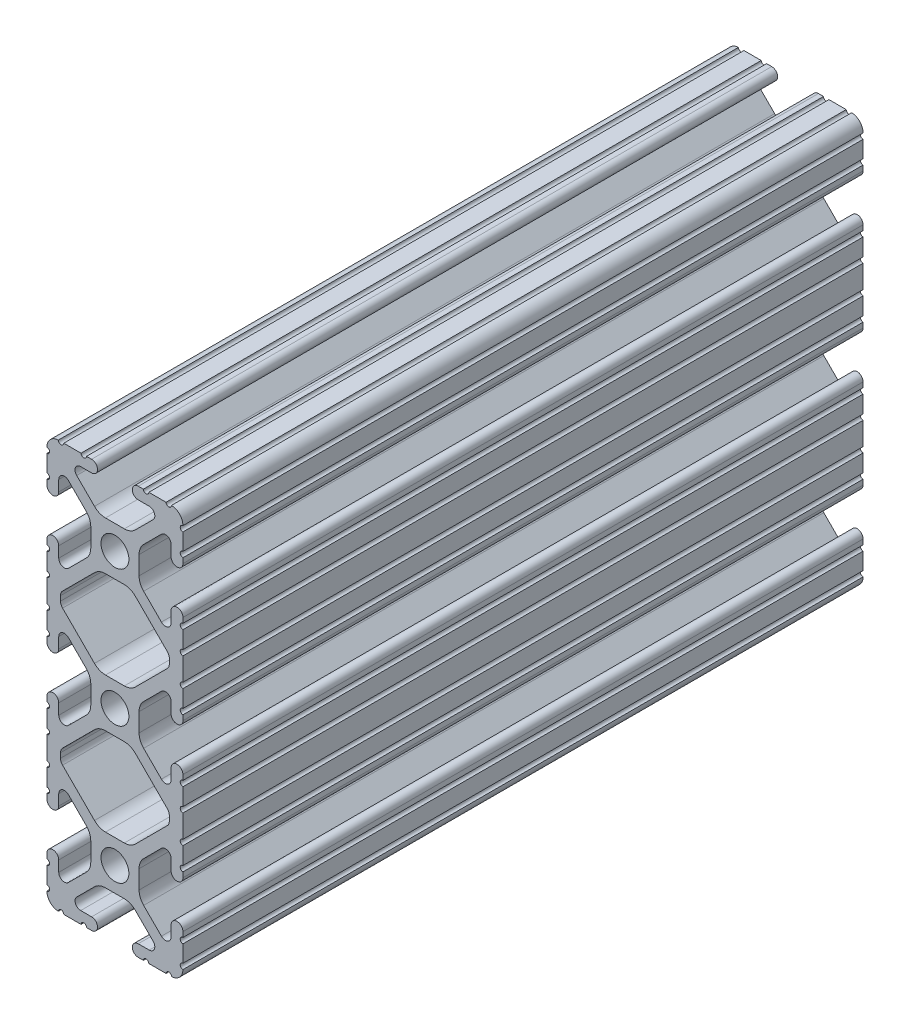
from build123d import *
from build123d.topology import SkipClean

# Parameters (mm, degrees)
BOSS_EXTRUDE1_DEPTH = 1524
SKETCH4_W           = 25.498526027
SKETCH4_H           = 76.344135488
CUT_EXTRUDE1_DEPTH  = 2921


with BuildPart() as part:
    # Sketch3 → Boss-Extrude1 (new, symmetric)
    with BuildSketch(Plane.XY):
        with BuildLine():
            Line((-4.5085, 1.724757315), (-4.5085, 0))
            Line((-4.5085, 0), (-2.6035, 0))
            ThreePointArc((-2.6035, 0), (-1.840952505, 1.840952505), (0, 2.6035))
            Line((0, 2.6035), (0, 4.5085))
            Line((0, 4.5085), (-1.757798948, 4.5085))
            ThreePointArc((-1.757798948, 4.5085), (-2.870757174, 4.729881156), (-3.8142776, 5.360321348))
            Line((-3.8142776, 5.360321348), (-9.773146637, 11.319190385))
            ThreePointArc((-9.773146637, 11.319190385), (-10.059460087, 11.747688744), (-10.16, 12.253137022))
            Line((-10.16, 12.253137022), (-10.16, 13.146862978))
            ThreePointArc((-10.16, 13.146862978), (-10.059460087, 13.652311256), (-9.773146637, 14.080809615))
            Line((-9.773146637, 14.080809615), (-3.8142776, 20.039678652))
            ThreePointArc((-3.8142776, 20.039678652), (-2.870757174, 20.670118844), (-1.757798948, 20.8915))
            Line((-1.757798948, 20.8915), (0, 20.8915))
            Line((0, 20.8915), (0, 22.7965))
            ThreePointArc((0, 22.7965), (-2.6035, 25.4), (0, 28.0035))
            Line((0, 28.0035), (0, 29.9085))
            Line((0, 29.9085), (-1.757798948, 29.9085))
            ThreePointArc((-1.757798948, 29.9085), (-2.870757174, 30.129881156), (-3.8142776, 30.760321348))
            Line((-3.8142776, 30.760321348), (-7.140358942, 34.086402691))
            ThreePointArc((-7.140358942, 34.086402691), (-7.369409702, 35.237918622), (-6.393201633, 35.8902))
            Line((-6.393201633, 35.8902), (-4.3561, 35.8902))
            ThreePointArc((-4.3561, 35.8902), (-3.2512, 36.9951), (-4.3561, 38.1))
            Line((-4.3561, 38.1), (-5.3086, 38.1))
            ThreePointArc((-5.3086, 38.1), (-5.8166, 37.592), (-6.3246, 38.1))
            Line((-6.3246, 38.1), (-9.5504, 38.1))
            ThreePointArc((-9.5504, 38.1), (-10.0584, 37.592), (-10.5664, 38.1))
            ThreePointArc((-10.5664, 38.1), (-12.079551533, 37.426060101), (-12.7, 35.8902))
            ThreePointArc((-12.7, 35.8902), (-12.192, 35.3822), (-12.7, 34.8742))
            Line((-12.7, 34.8742), (-12.7, 31.7246))
            ThreePointArc((-12.7, 31.7246), (-12.192, 31.2166), (-12.7, 30.7086))
            Line((-12.7, 30.7086), (-12.7, 29.7561))
            ThreePointArc((-12.7, 29.7561), (-11.5951, 28.6512), (-10.4902, 29.7561))
            Line((-10.4902, 29.7561), (-10.4902, 31.76016))
            ThreePointArc((-10.4902, 31.76016), (-9.837918622, 32.736368069), (-8.686402691, 32.507317309))
            Line((-8.686402691, 32.507317309), (-5.360321348, 29.181235967))
            ThreePointArc((-5.360321348, 29.181235967), (-4.729881156, 28.237715541), (-4.5085, 27.124757315))
            Line((-4.5085, 27.124757315), (-4.5085, 23.675242685))
            ThreePointArc((-4.5085, 23.675242685), (-4.729881156, 22.562284459), (-5.360321348, 21.618764033))
            Line((-5.360321348, 21.618764033), (-8.686402691, 18.292682691))
            ThreePointArc((-8.686402691, 18.292682691), (-9.837918622, 18.063631931), (-10.4902, 19.03984))
            Line((-10.4902, 19.03984), (-10.4902, 21.0439))
            ThreePointArc((-10.4902, 21.0439), (-11.5951, 22.1488), (-12.7, 21.0439))
            Line((-12.7, 21.0439), (-12.7, 20.0914))
            ThreePointArc((-12.7, 20.0914), (-12.192, 19.5834), (-12.7, 19.0754))
            Line((-12.7, 19.0754), (-12.7, 15.8496))
            ThreePointArc((-12.7, 15.8496), (-12.192, 15.3416), (-12.7, 14.8336))
            Line((-12.7, 14.8336), (-12.7, 10.5664))
            ThreePointArc((-12.7, 10.5664), (-12.192, 10.0584), (-12.7, 9.5504))
            Line((-12.7, 9.5504), (-12.7, 6.3246))
            ThreePointArc((-12.7, 6.3246), (-12.192, 5.8166), (-12.7, 5.3086))
            Line((-12.7, 5.3086), (-12.7, 4.3561))
            ThreePointArc((-12.7, 4.3561), (-11.5951, 3.2512), (-10.4902, 4.3561))
            Line((-10.4902, 4.3561), (-10.4902, 6.36016))
            ThreePointArc((-10.4902, 6.36016), (-9.837918622, 7.336368069), (-8.686402691, 7.107317309))
            Line((-8.686402691, 7.107317309), (-5.360321348, 3.781235967))
            ThreePointArc((-5.360321348, 3.781235967), (-4.729881156, 2.837715541), (-4.5085, 1.724757315))
        make_face()
    extrude(amount=BOSS_EXTRUDE1_DEPTH, both=True)

    # Mirror1: part across plane


with BuildPart() as part_1:
    with SkipClean():  # the faces are left unmerged after this step: merging them gives an invalid solid
        add(part.part)
        add(part.part.mirror(Plane(origin=(0, 0, 0), x_dir=(0, 0, 1), z_dir=(1, 0, 0))))

    # Mirror2: part across plane


with BuildPart() as part_2:
    with SkipClean():  # the faces are left unmerged after this step: merging them gives an invalid solid
        add(part_1.part)
        add(part_1.part.mirror(Plane.ZX))

    # Sketch4 → Cut-Extrude1 (cut)
    with SkipClean():  # the faces are left unmerged after this step: merging them gives an invalid solid
        with BuildSketch(Plane.XY.offset(1524)):
            with Locations((0.049263014, -0.072067744)):
                Rectangle(SKETCH4_W, SKETCH4_H)
        extrude(amount=-CUT_EXTRUDE1_DEPTH, mode=Mode.SUBTRACT)


solid = part_2.part
